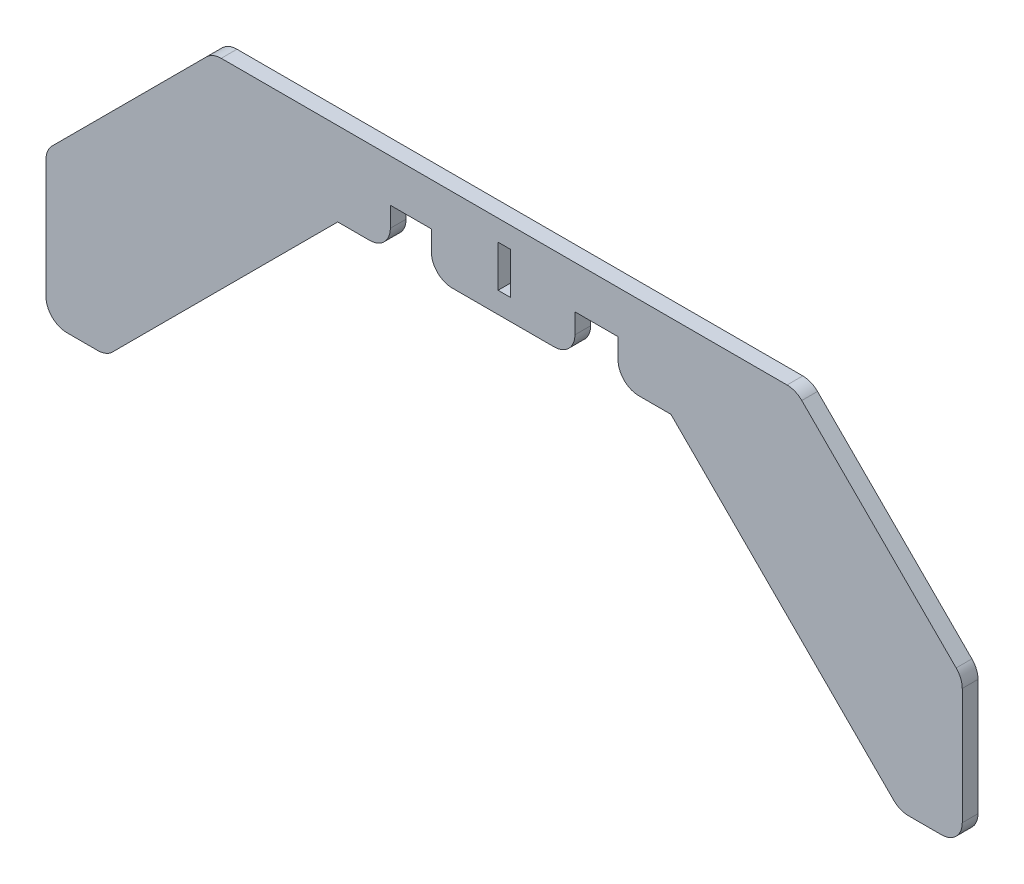
from build123d import *

# Parameters (mm, degrees)
SKETCH1_W           = 279.4
SKETCH1_H           = 254
BOSS_EXTRUDE1_DEPTH = 4.800000052
SKETCH4_W           = 13.148347957
SKETCH4_H           = 12.442555781
SKETCH4_W_2         = 3.81
SKETCH4_H_2         = 12.7
SKETCH4_W_3         = 12.512633495
CUT_EXTRUDE1_DEPTH  = 378.628653575
FILLET1_R           = 6.35


with BuildPart() as part:
    # Sketch1 → Boss-Extrude1 (new body)
    with BuildSketch(Plane.XY):
        with Locations((139.7, 127)):
            Rectangle(SKETCH1_W, SKETCH1_H)
    extrude(amount=BOSS_EXTRUDE1_DEPTH)

    # Sketch4 → Cut-Extrude1 (cut, through all)
    with BuildSketch(Plane(origin=(0, 0, 0), x_dir=(-1, 0, 0), z_dir=(0, 0, -1))):
        Polygon((0, 0), (0, 72.724077305), (-18.411229684, 72.724077305), (-88.95741747, 143.27026509), (-105.001094941, 143.27026509), (-117.513728436, 143.27026509), (-161.28323771, 143.27026509), (-174.431585667, 143.27026509), (-190.55741747, 143.27026509), (-260.35, 73.47768256), (-279.4, 73.47768256), (-279.4, 0), align=None)
        Polygon((-190.5, 168.72768256), (-88.9, 168.72768256), (-50.8, 168.72768256), (0, 117.92768256), (0, 254), (-279.4, 254), (-279.4, 117.92768256), (-228.6, 168.72768256), align=None)
        with Locations((-167.857411689, 149.491542981)):
            Rectangle(SKETCH4_W, SKETCH4_H)
        with Locations((-139.75741747, 156.02768256)):
            Rectangle(SKETCH4_W_2, SKETCH4_H_2)
        with Locations((-111.257411689, 149.491542981)):
            Rectangle(SKETCH4_W_3, SKETCH4_H)
    extrude(amount=-CUT_EXTRUDE1_DEPTH, mode=Mode.SUBTRACT)

    # Fillet1
    fillet1_edges = [part.edges().sort_by_distance(p)[0] for p in [
        (18.411229684, 72.724077305, 2.400000026),
        (0, 72.724077305, 2.400000026),
        (279.4, 73.47768256, 2.400000026),
        (260.35, 73.47768256, 2.400000026),
        (174.431585667, 143.27026509, 2.400000026),
        (161.28323771, 143.27026509, 2.400000026),
        (117.513728436, 143.27026509, 2.400000026),
        (105.001094941, 143.27026509, 2.400000026),
        (228.6, 168.72768256, 2.400000026),
        (279.4, 117.92768256, 2.400000026),
        (0, 117.92768256, 2.400000026),
        (50.8, 168.72768256, 2.400000026),
    ]]
    fillet(fillet1_edges, radius=FILLET1_R)


solid = part.part
